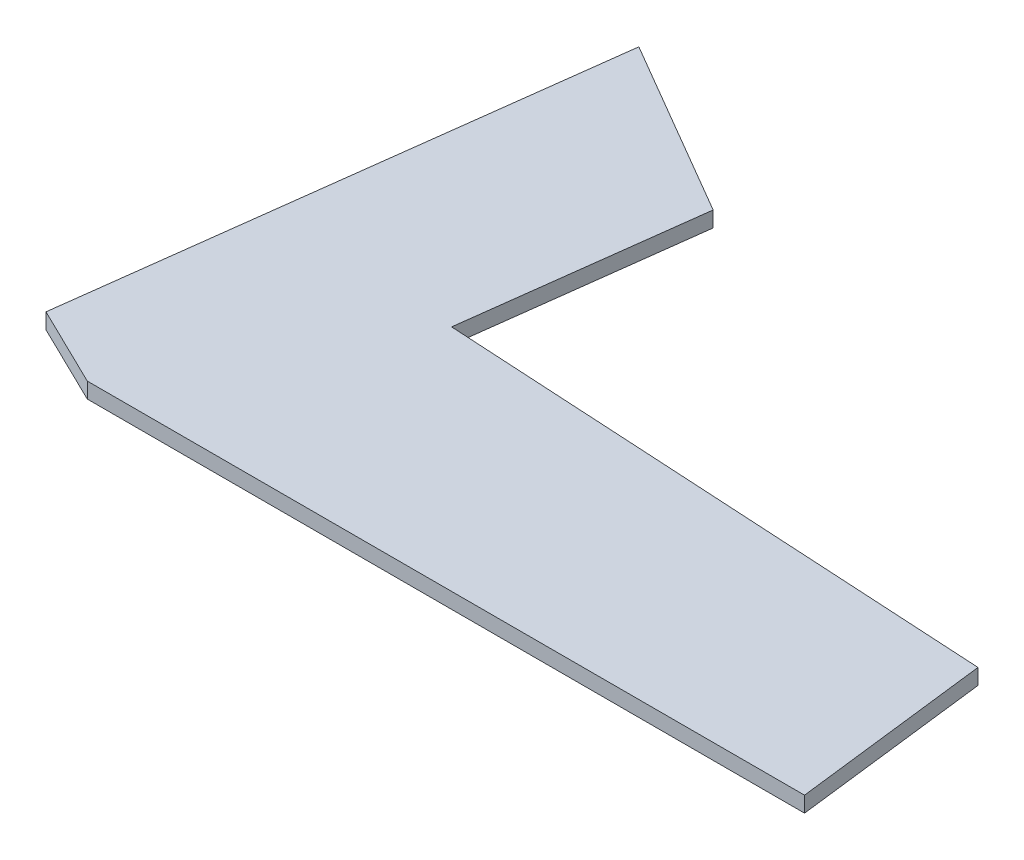
from build123d import *

# Parameters (mm, degrees)
BOSS_EXTRUDE1_DEPTH = 1


with BuildPart() as part:
    # Sketch1 → Boss-Extrude1 (new body)
    with BuildSketch(Plane(origin=(0, 0, 0), x_dir=(1, 0, 0), z_dir=(0, 1, 0))):
        Polygon((0, 0), (1.893521143, 14.880005971), (-9.550664273, 21.557814007), (-13.84264553, -12.170199526), (-8.674776379, -14.691236702), (37.325223621, -14.691236702), (35.792268072, -2.03372718), align=None)
    extrude(amount=BOSS_EXTRUDE1_DEPTH)


solid = part.part
